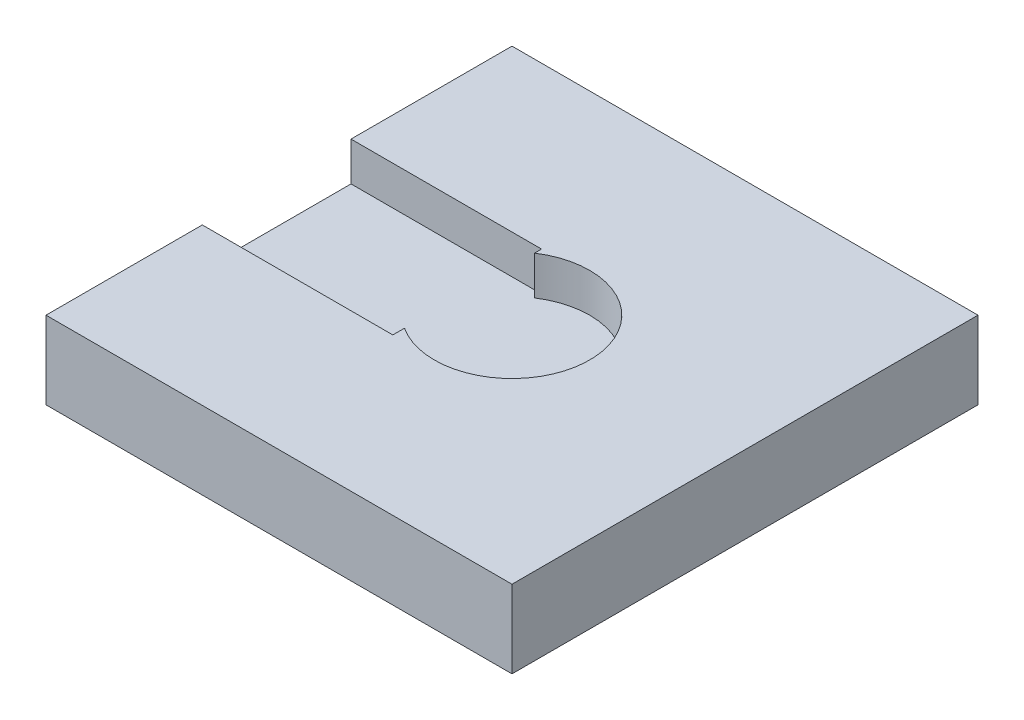
from build123d import *

# Parameters (mm, degrees)
SKETCH1_W           = 60
SKETCH1_H           = 60
BOSS_EXTRUDE1_DEPTH = 10
SKETCH3_R           = 10
CUT_EXTRUDE1_DEPTH  = 5
SKETCH4_W           = 24.532497745
SKETCH4_H           = 19.147026564
CUT_EXTRUDE2_DEPTH  = 5


with BuildPart() as part:
    # Sketch1 → Boss-Extrude1 (new body)
    with BuildSketch(Plane(origin=(0, 0, 0), x_dir=(1, 0, 0), z_dir=(0, 1, 0))):
        Rectangle(SKETCH1_W, SKETCH1_H)
    extrude(amount=BOSS_EXTRUDE1_DEPTH)

    # Sketch3 → Cut-Extrude1 (cut)
    with BuildSketch(Plane(origin=(0, 10, 0), x_dir=(1, 0, 0), z_dir=(0, 1, 0))):
        with Locations(Location((0, 0, 0), (0, 0, 270))):
            Circle(SKETCH3_R)
    extrude(amount=-CUT_EXTRUDE1_DEPTH, mode=Mode.SUBTRACT)

    # Sketch4 → Cut-Extrude2 (cut)
    with BuildSketch(Plane(origin=(0, 10, 0), x_dir=(1, 0, 0), z_dir=(0, 1, 0))):
        with Locations((-17.733751128, -0.302151095)):
            Rectangle(SKETCH4_W, SKETCH4_H)
    extrude(amount=-CUT_EXTRUDE2_DEPTH, mode=Mode.SUBTRACT)


solid = part.part
